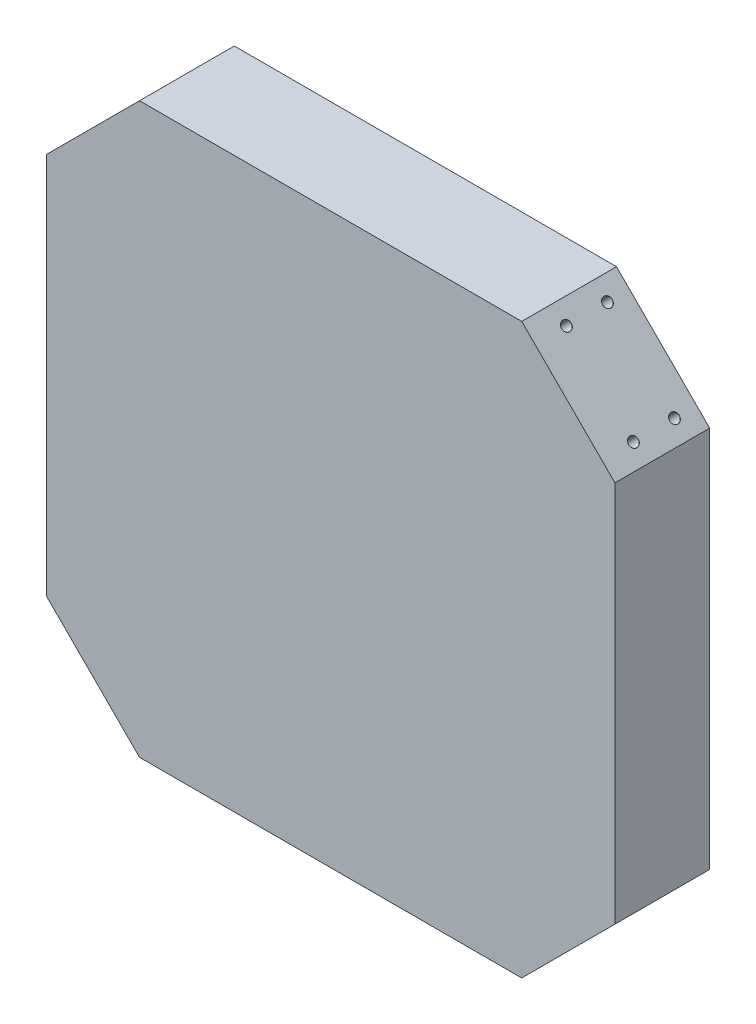
from build123d import *

# Parameters (mm, degrees)
BOSS_EXTRUDE1_DEPTH            = 30
SHELL1_T                       = -5
F_3_0MM_DOWEL_HOLE1_AT_2_COUNT = 2
F_3_0MM_DOWEL_HOLE1_AT_2_PITCH = 30
F_3_0MM_DOWEL_HOLE1_AT_3_COUNT = 2
F_3_0MM_DOWEL_HOLE1_AT_3_PITCH = 32.695565449
F_3_0MM_DOWEL_HOLE1_AT_4_COUNT = 2
F_3_0MM_DOWEL_HOLE1_AT_4_PITCH = 13
BOSS_EXTRUDE2_DEPTH            = 3
SKETCH5_W                      = 55
SKETCH5_H                      = 170
CUT_EXTRUDE3_DEPTH             = 5


with BuildPart() as part:
    # Sketch1 → Boss-Extrude1 (new body)
    with BuildSketch(Plane.XY):
        Polygon((-60.491803279, 90), (60.491803279, 90), (90, 60.491803279), (90, -60.491803279), (60.491803279, -90), (-60.491803279, -90), (-90, -60.491803279), (-90, 60.491803279), align=None)
    extrude(amount=BOSS_EXTRUDE1_DEPTH)

    # Shell1
    shell1_openings = [part.faces().sort_by_distance(p)[0] for p in [
        (0, 0, 0),
    ]]
    offset(amount=SHELL1_T, openings=shell1_openings, kind=Kind.INTERSECTION)

    # Sketch3 → Ø3.0mm Dowel Hole1 (revolve, cut)
    with BuildSketch(Plane(origin=(-64.639299922, -85.852503357, 7), x_dir=(0.7071067811865476, -0.7071067811865475, 0), z_dir=(0, 0, 1))):
        Polygon((0, 0), (0, 30), (1.5, 29.098709071), (1.5, 0.025), (1.525, 0), align=None)
    f_3_0mm_dowel_hole1 = revolve(axis=Axis((-69.129427982, -90.342631418, 7), (0.7071067811865475, 0.7071067811865476, 0)), mode=Mode.SUBTRACT)

    # Ø3.0mm Dowel Hole1 at 2: Ø3.0mm Dowel Hole1 ×2
    with Locations(*[Vector(-0.7071067811865476, 0.7071067811865475, 0) * (i * F_3_0MM_DOWEL_HOLE1_AT_2_PITCH) for i in range(1, F_3_0MM_DOWEL_HOLE1_AT_2_COUNT)]):
        add(f_3_0mm_dowel_hole1, mode=Mode.SUBTRACT)

    # Ø3.0mm Dowel Hole1 at 3: Ø3.0mm Dowel Hole1 ×2
    with Locations(*[Vector(-0.6488098047725105, 0.6488098047725104, 0.3976074376343002) * (i * F_3_0MM_DOWEL_HOLE1_AT_3_PITCH) for i in range(1, F_3_0MM_DOWEL_HOLE1_AT_3_COUNT)]):
        add(f_3_0mm_dowel_hole1, mode=Mode.SUBTRACT)

    # Ø3.0mm Dowel Hole1 at 4: Ø3.0mm Dowel Hole1 ×2
    with Locations(*[(0, 0, i * F_3_0MM_DOWEL_HOLE1_AT_4_PITCH) for i in range(1, F_3_0MM_DOWEL_HOLE1_AT_4_COUNT)]):
        add(f_3_0mm_dowel_hole1, mode=Mode.SUBTRACT)

    # Mirror2: Ø3.0mm Dowel Hole1 across plane
    add(f_3_0mm_dowel_hole1.mirror(Plane.ZX), mode=Mode.SUBTRACT)

    # Mirror2 copy 1 sketch → Mirror2 copy 1 (revolve, cut)
    with BuildSketch(Plane(origin=(-85.852503357, 64.639299922, 7), x_dir=(0.7071067811865476, 0.7071067811865475, 0), z_dir=(0, 0, 1))):
        Polygon((0, 0), (0, -30), (1.5, -29.098709071), (1.5, -0.025), (1.525, 0), align=None)
    revolve(axis=Axis((-90.342631418, 69.129427982, 7), (-0.7071067811865475, 0.7071067811865476, 0)), mode=Mode.SUBTRACT)

    # Mirror2 copy 2 sketch → Mirror2 copy 2 (revolve, cut)
    with BuildSketch(Plane(origin=(-85.852503357, 64.639299922, 20), x_dir=(0.7071067811865476, 0.7071067811865475, 0), z_dir=(0, 0, 1))):
        Polygon((0, 0), (0, -30), (1.5, -29.098709071), (1.5, -0.025), (1.525, 0), align=None)
    revolve(axis=Axis((-90.342631418, 69.129427982, 20), (-0.7071067811865475, 0.7071067811865476, 0)), mode=Mode.SUBTRACT)

    # Mirror2 copy 3 sketch → Mirror2 copy 3 (revolve, cut)
    with BuildSketch(Plane(origin=(-64.639299922, 85.852503357, 20), x_dir=(0.7071067811865476, 0.7071067811865475, 0), z_dir=(0, 0, 1))):
        Polygon((0, 0), (0, -30), (1.5, -29.098709071), (1.5, -0.025), (1.525, 0), align=None)
    revolve(axis=Axis((-69.129427982, 90.342631418, 20), (-0.7071067811865475, 0.7071067811865476, 0)), mode=Mode.SUBTRACT)

    # Mirror3: Ø3.0mm Dowel Hole1 across plane
    add(f_3_0mm_dowel_hole1.mirror(Plane(origin=(0, 0, 0), x_dir=(0, 0, 1), z_dir=(1, 0, 0))), mode=Mode.SUBTRACT)

    # Mirror3 copy 1 sketch → Mirror3 copy 1 (revolve, cut)
    with BuildSketch(Plane(origin=(85.852503357, -64.639299922, 7), x_dir=(-0.7071067811865476, -0.7071067811865475, 0), z_dir=(0, 0, 1))):
        Polygon((0, 0), (0, -30), (1.5, -29.098709071), (1.5, -0.025), (1.525, 0), align=None)
    revolve(axis=Axis((90.342631418, -69.129427982, 7), (0.7071067811865475, -0.7071067811865476, 0)), mode=Mode.SUBTRACT)

    # Mirror3 copy 2 sketch → Mirror3 copy 2 (revolve, cut)
    with BuildSketch(Plane(origin=(85.852503357, -64.639299922, 20), x_dir=(-0.7071067811865476, -0.7071067811865475, 0), z_dir=(0, 0, 1))):
        Polygon((0, 0), (0, -30), (1.5, -29.098709071), (1.5, -0.025), (1.525, 0), align=None)
    revolve(axis=Axis((90.342631418, -69.129427982, 20), (0.7071067811865475, -0.7071067811865476, 0)), mode=Mode.SUBTRACT)

    # Mirror3 copy 3 sketch → Mirror3 copy 3 (revolve, cut)
    with BuildSketch(Plane(origin=(64.639299922, -85.852503357, 20), x_dir=(-0.7071067811865476, -0.7071067811865475, 0), z_dir=(0, 0, 1))):
        Polygon((0, 0), (0, -30), (1.5, -29.098709071), (1.5, -0.025), (1.525, 0), align=None)
    revolve(axis=Axis((69.129427982, -90.342631418, 20), (0.7071067811865475, -0.7071067811865476, 0)), mode=Mode.SUBTRACT)

    # Mirror3 copy 4 sketch → Mirror3 copy 4 (revolve, cut)
    with BuildSketch(Plane(origin=(64.639299922, 85.852503357, 7), x_dir=(-0.7071067811865476, 0.7071067811865475, 0), z_dir=(0, 0, 1))):
        Polygon((0, 0), (0, 30), (1.5, 29.098709071), (1.5, 0.025), (1.525, 0), align=None)
    revolve(axis=Axis((69.129427982, 90.342631418, 7), (-0.7071067811865475, -0.7071067811865476, 0)), mode=Mode.SUBTRACT)

    # Mirror3 copy 5 sketch → Mirror3 copy 5 (revolve, cut)
    with BuildSketch(Plane(origin=(85.852503357, 64.639299922, 7), x_dir=(-0.7071067811865476, 0.7071067811865475, 0), z_dir=(0, 0, 1))):
        Polygon((0, 0), (0, 30), (1.5, 29.098709071), (1.5, 0.025), (1.525, 0), align=None)
    revolve(axis=Axis((90.342631418, 69.129427982, 7), (-0.7071067811865475, -0.7071067811865476, 0)), mode=Mode.SUBTRACT)

    # Mirror3 copy 6 sketch → Mirror3 copy 6 (revolve, cut)
    with BuildSketch(Plane(origin=(85.852503357, 64.639299922, 20), x_dir=(-0.7071067811865476, 0.7071067811865475, 0), z_dir=(0, 0, 1))):
        Polygon((0, 0), (0, 30), (1.5, 29.098709071), (1.5, 0.025), (1.525, 0), align=None)
    revolve(axis=Axis((90.342631418, 69.129427982, 20), (-0.7071067811865475, -0.7071067811865476, 0)), mode=Mode.SUBTRACT)

    # Mirror3 copy 7 sketch → Mirror3 copy 7 (revolve, cut)
    with BuildSketch(Plane(origin=(64.639299922, 85.852503357, 20), x_dir=(-0.7071067811865476, 0.7071067811865475, 0), z_dir=(0, 0, 1))):
        Polygon((0, 0), (0, 30), (1.5, 29.098709071), (1.5, 0.025), (1.525, 0), align=None)
    revolve(axis=Axis((69.129427982, 90.342631418, 20), (-0.7071067811865475, -0.7071067811865476, 0)), mode=Mode.SUBTRACT)

    # Sketch4 → Boss-Extrude2 (add)
    with BuildSketch(Plane(origin=(0, 0, 25), x_dir=(-1, 0, 0), z_dir=(0, 0, -1))):
        Polygon((-58.420735467, 85), (58.420735467, 85), (85, 58.420735467), (85, -58.420735467), (58.420735467, -85), (-58.420735467, -85), (-85, -58.420735467), (-85, 58.420735467), align=None)
    extrude(amount=BOSS_EXTRUDE2_DEPTH)

    # Sketch5 → Cut-Extrude3 (cut)
    with BuildSketch(Plane(origin=(0, 0, 22), x_dir=(-1, 0, 0), z_dir=(0, 0, -1))):
        Rectangle(SKETCH5_W, SKETCH5_H)
    extrude(amount=-CUT_EXTRUDE3_DEPTH, mode=Mode.SUBTRACT)


solid = part.part
